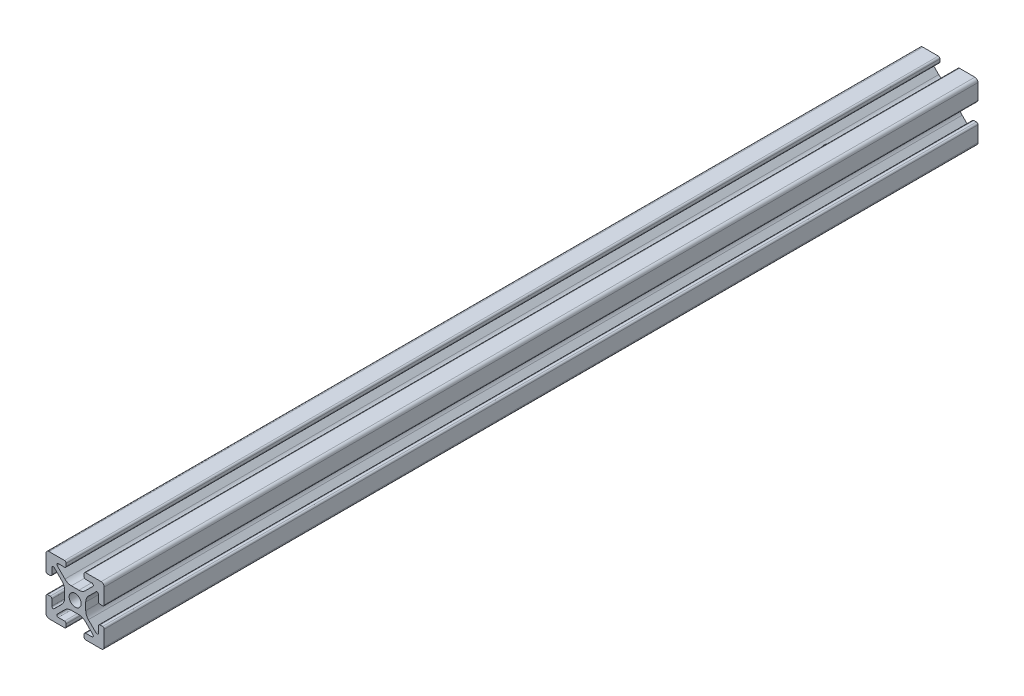
from build123d import *

# Parameters (mm, degrees)
SKETCH2_R           = 2.05
BOSS_EXTRUDE1_DEPTH = 300
SKETCH4_R           = 2.8
CUT_EXTRUDE1_DEPTH  = 43


with BuildPart() as part:
    # Sketch2 → Boss-Extrude1 (new body)
    with BuildSketch(Plane.XY):
        with BuildLine():
            Line((-3.642230561, 1.287773026), (-3.642230561, -1.287773026))
            ThreePointArc((-3.642230561, -1.287773026), (-3.87999308, -2.483085929), (-4.55708345, -3.496423279))
            Line((-4.55708345, -3.496423279), (-7.182004606, -6.121344434))
            ThreePointArc((-7.182004606, -6.121344434), (-7.704200045, -6.225215565), (-8, -5.782519648))
            Line((-8, -5.782519648), (-8, -3.622007668))
            ThreePointArc((-8, -3.622007668), (-8.161974206, -3.230967343), (-8.553014531, -3.068993137))
            Line((-8.553014531, -3.068993137), (-9.443284204, -3.068993137))
            ThreePointArc((-9.443284204, -3.068993137), (-9.836715763, -3.229656566), (-10, -3.622007668))
            Line((-10, -3.622007668), (-10, -8.939033256))
            ThreePointArc((-10, -8.939033256), (-9.689250035, -9.689250035), (-8.939033256, -10))
            Line((-8.939033256, -10), (-3.622007668, -10))
            ThreePointArc((-3.622007668, -10), (-3.229656566, -9.836715763), (-3.068993137, -9.443284204))
            Line((-3.068993137, -9.443284204), (-3.068993137, -8.553014531))
            ThreePointArc((-3.068993137, -8.553014531), (-3.230967343, -8.161974206), (-3.622007668, -8))
            Line((-3.622007668, -8), (-5.782519648, -8))
            ThreePointArc((-5.782519648, -8), (-6.225215565, -7.704200045), (-6.121344434, -7.182004606))
            Line((-6.121344434, -7.182004606), (-3.496423279, -4.55708345))
            ThreePointArc((-3.496423279, -4.55708345), (-2.483085929, -3.87999308), (-1.287773026, -3.642230561))
            Line((-1.287773026, -3.642230561), (1.287773026, -3.642230561))
            ThreePointArc((1.287773026, -3.642230561), (2.483085929, -3.87999308), (3.496423279, -4.55708345))
            Line((3.496423279, -4.55708345), (6.121344434, -7.182004606))
            ThreePointArc((6.121344434, -7.182004606), (6.225215565, -7.704200045), (5.782519648, -8))
            Line((5.782519648, -8), (3.622007668, -8))
            ThreePointArc((3.622007668, -8), (3.230967343, -8.161974206), (3.068993137, -8.553014531))
            Line((3.068993137, -8.553014531), (3.068993137, -9.443284204))
            ThreePointArc((3.068993137, -9.443284204), (3.229656566, -9.836715763), (3.622007668, -10))
            Line((3.622007668, -10), (8.939033256, -10))
            ThreePointArc((8.939033256, -10), (9.689250035, -9.689250035), (10, -8.939033256))
            Line((10, -8.939033256), (10, -3.622007668))
            ThreePointArc((10, -3.622007668), (9.836715763, -3.229656566), (9.443284204, -3.068993137))
            Line((9.443284204, -3.068993137), (8.553014531, -3.068993137))
            ThreePointArc((8.553014531, -3.068993137), (8.161974206, -3.230967343), (8, -3.622007668))
            Line((8, -3.622007668), (8, -5.782519648))
            ThreePointArc((8, -5.782519648), (7.704200045, -6.225215565), (7.182004606, -6.121344434))
            Line((7.182004606, -6.121344434), (4.55708345, -3.496423279))
            ThreePointArc((4.55708345, -3.496423279), (3.87999308, -2.483085929), (3.642230561, -1.287773026))
            Line((3.642230561, -1.287773026), (3.642230561, 1.287773026))
            ThreePointArc((3.642230561, 1.287773026), (3.87999308, 2.483085929), (4.55708345, 3.496423279))
            Line((4.55708345, 3.496423279), (7.182004606, 6.121344434))
            ThreePointArc((7.182004606, 6.121344434), (7.704200045, 6.225215565), (8, 5.782519648))
            Line((8, 5.782519648), (8, 3.622007668))
            ThreePointArc((8, 3.622007668), (8.161974206, 3.230967343), (8.553014531, 3.068993137))
            Line((8.553014531, 3.068993137), (9.443284204, 3.068993137))
            ThreePointArc((9.443284204, 3.068993137), (9.836715763, 3.229656566), (10, 3.622007668))
            Line((10, 3.622007668), (10, 8.939033256))
            ThreePointArc((10, 8.939033256), (9.689250035, 9.689250035), (8.939033256, 10))
            Line((8.939033256, 10), (3.622007668, 10))
            ThreePointArc((3.622007668, 10), (3.229656566, 9.836715763), (3.068993137, 9.443284204))
            Line((3.068993137, 9.443284204), (3.068993137, 8.553014531))
            ThreePointArc((3.068993137, 8.553014531), (3.230967343, 8.161974206), (3.622007668, 8))
            Line((3.622007668, 8), (5.782519648, 8))
            ThreePointArc((5.782519648, 8), (6.225215565, 7.704200045), (6.121344434, 7.182004606))
            Line((6.121344434, 7.182004606), (3.496423279, 4.55708345))
            ThreePointArc((3.496423279, 4.55708345), (2.483085929, 3.87999308), (1.287773026, 3.642230561))
            Line((1.287773026, 3.642230561), (-1.287773026, 3.642230561))
            ThreePointArc((-1.287773026, 3.642230561), (-2.483085929, 3.87999308), (-3.496423279, 4.55708345))
            Line((-3.496423279, 4.55708345), (-6.121344434, 7.182004606))
            ThreePointArc((-6.121344434, 7.182004606), (-6.225215565, 7.704200045), (-5.782519648, 8))
            Line((-5.782519648, 8), (-3.622007668, 8))
            ThreePointArc((-3.622007668, 8), (-3.230967343, 8.161974206), (-3.068993137, 8.553014531))
            Line((-3.068993137, 8.553014531), (-3.068993137, 9.443284204))
            ThreePointArc((-3.068993137, 9.443284204), (-3.229656566, 9.836715763), (-3.622007668, 10))
            Line((-3.622007668, 10), (-8.939033256, 10))
            ThreePointArc((-8.939033256, 10), (-9.689250035, 9.689250035), (-10, 8.939033256))
            Line((-10, 8.939033256), (-10, 3.622007668))
            ThreePointArc((-10, 3.622007668), (-9.836715763, 3.229656566), (-9.443284204, 3.068993137))
            Line((-9.443284204, 3.068993137), (-8.553014531, 3.068993137))
            ThreePointArc((-8.553014531, 3.068993137), (-8.161974206, 3.230967343), (-8, 3.622007668))
            Line((-8, 3.622007668), (-8, 5.782519648))
            ThreePointArc((-8, 5.782519648), (-7.704200045, 6.225215565), (-7.182004606, 6.121344434))
            Line((-7.182004606, 6.121344434), (-4.55708345, 3.496423279))
            ThreePointArc((-4.55708345, 3.496423279), (-3.87999308, 2.483085929), (-3.642230561, 1.287773026))
        make_face()
        Circle(SKETCH2_R, mode=Mode.SUBTRACT)
    extrude(amount=-BOSS_EXTRUDE1_DEPTH)

    # Sketch4 → Cut-Extrude1 (cut)
    with BuildSketch(Plane.XZ.offset(10)):
        with Locations(Location((0, -260, 0), (0, 0, 297.381876825))):
            Circle(SKETCH4_R)
    extrude(amount=-CUT_EXTRUDE1_DEPTH, mode=Mode.SUBTRACT)


solid = part.part
